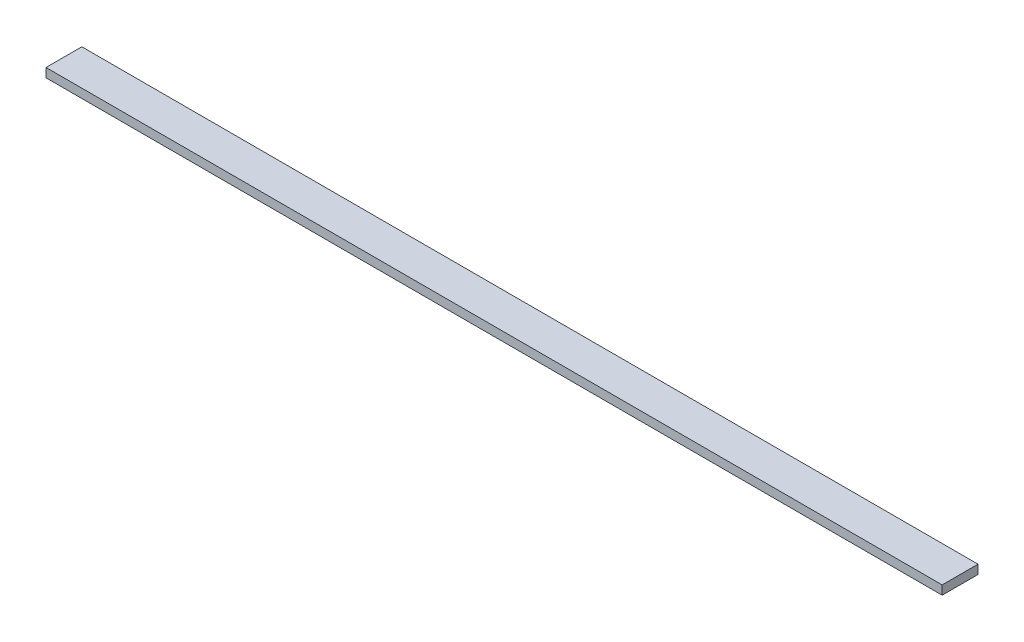
from build123d import *

# Parameters (mm, degrees)
SKETCH1_W           = 500
SKETCH1_H           = 20
BOSS_EXTRUDE1_DEPTH = 5


with BuildPart() as part:
    # Sketch1 → Boss-Extrude1 (new body)
    with BuildSketch(Plane(origin=(0, 0, 0), x_dir=(1, 0, 0), z_dir=(0, 1, 0))):
        Rectangle(SKETCH1_W, SKETCH1_H)
    extrude(amount=BOSS_EXTRUDE1_DEPTH)


solid = part.part
